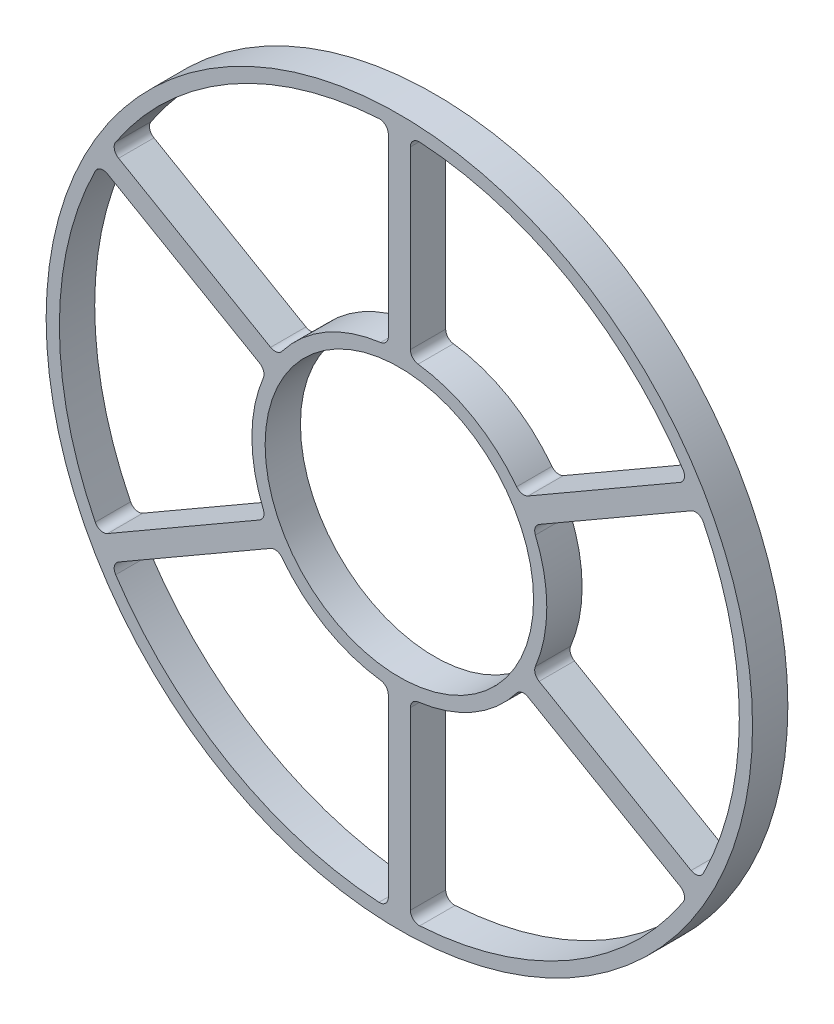
from build123d import *

# Parameters (mm, degrees)
SKETCH1_R           = 40
SKETCH1_R_2         = 15.2
BOSS_EXTRUDE1_DEPTH = 2
FILLET2_R           = 1


with BuildPart() as part:
    # Sketch1 → Boss-Extrude1 (new, symmetric)
    with BuildSketch(Plane.XY):
        Circle(SKETCH1_R)
        Circle(SKETCH1_R_2, mode=Mode.SUBTRACT)
        with BuildLine():
            ThreePointArc((1.25, -38.479702442), (19.25, -33.341978046), (32.699399845, -20.322382976))
            Line((32.699399845, -20.322382976), (13.797053425, -9.409108182))
            ThreePointArc((13.797053425, -9.409108182), (8.35, -14.462624243), (1.25, -16.653152855))
            Line((1.25, -16.653152855), (1.25, -38.479702442))
        make_face(mode=Mode.SUBTRACT)
        with BuildLine():
            ThreePointArc((33.949399845, -18.157319466), (38.5, 0), (33.949399845, 18.157319466))
            Line((33.949399845, 18.157319466), (15.047053425, 7.244044673))
            ThreePointArc((15.047053425, 7.244044673), (16.7, 0), (15.047053425, -7.244044673))
            Line((15.047053425, -7.244044673), (33.949399845, -18.157319466))
        make_face(mode=Mode.SUBTRACT)
        with BuildLine():
            ThreePointArc((-1.25, 38.479702442), (-19.25, 33.341978046), (-32.699399845, 20.322382976))
            Line((-32.699399845, 20.322382976), (-13.797053425, 9.409108182))
            ThreePointArc((-13.797053425, 9.409108182), (-8.35, 14.462624243), (-1.25, 16.653152855))
            Line((-1.25, 16.653152855), (-1.25, 38.479702442))
        make_face(mode=Mode.SUBTRACT)
        with BuildLine():
            ThreePointArc((-32.699399845, -20.322382976), (-19.25, -33.341978046), (-1.25, -38.479702442))
            Line((-1.25, -38.479702442), (-1.25, -16.653152855))
            ThreePointArc((-1.25, -16.653152855), (-8.35, -14.462624243), (-13.797053425, -9.409108182))
            Line((-13.797053425, -9.409108182), (-32.699399845, -20.322382976))
        make_face(mode=Mode.SUBTRACT)
        with BuildLine():
            Line((-15.047053425, 7.244044673), (-33.949399845, 18.157319466))
            ThreePointArc((-33.949399845, 18.157319466), (-38.5, 0), (-33.949399845, -18.157319466))
            Line((-33.949399845, -18.157319466), (-15.047053425, -7.244044673))
            ThreePointArc((-15.047053425, -7.244044673), (-16.7, 0), (-15.047053425, 7.244044673))
        make_face(mode=Mode.SUBTRACT)
        with BuildLine():
            Line((13.797053425, 9.409108182), (32.699399845, 20.322382976))
            ThreePointArc((32.699399845, 20.322382976), (19.25, 33.341978046), (1.25, 38.479702442))
            Line((1.25, 38.479702442), (1.25, 16.653152855))
            ThreePointArc((1.25, 16.653152855), (8.35, 14.462624243), (13.797053425, 9.409108182))
        make_face(mode=Mode.SUBTRACT)
    extrude(amount=BOSS_EXTRUDE1_DEPTH, both=True)

    # Fillet2
    fillet2_edges = [part.edges().sort_by_distance(p)[0] for p in [
        (32.699399845, 20.322382976, 0),
        (1.25, 38.479702442, 0),
        (1.25, 16.653152855, 0),
        (13.797053425, 9.409108182, 0),
        (-33.949399845, 18.157319466, 0),
        (-33.949399845, -18.157319466, 0),
        (-15.047053425, -7.244044673, 0),
        (-15.047053425, 7.244044673, 0),
        (-1.25, -38.479702442, 0),
        (-1.25, -16.653152855, 0),
        (-13.797053425, -9.409108182, 0),
        (-32.699399845, -20.322382976, 0),
        (-32.699399845, 20.322382976, 0),
        (-13.797053425, 9.409108182, 0),
        (-1.25, 16.653152855, 0),
        (-1.25, 38.479702442, 0),
        (33.949399845, 18.157319466, 0),
        (15.047053425, 7.244044673, 0),
        (15.047053425, -7.244044673, 0),
        (33.949399845, -18.157319466, 0),
        (32.699399845, -20.322382976, 0),
        (13.797053425, -9.409108182, 0),
        (1.25, -16.653152855, 0),
        (1.25, -38.479702442, 0),
    ]]
    fillet(fillet2_edges, radius=FILLET2_R)


solid = part.part
